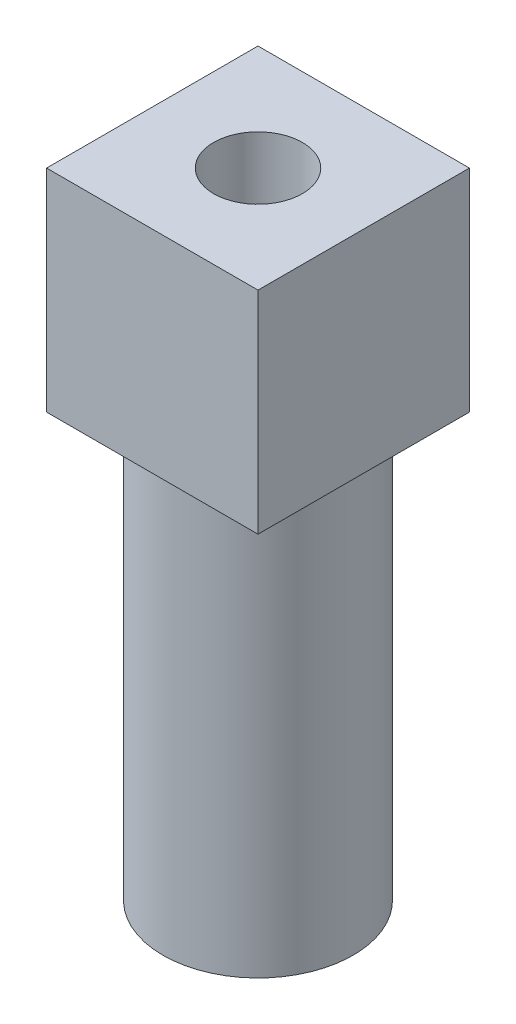
from build123d import *

# Parameters (mm, degrees)
SKIZZE1_W                       = 4.5
SKIZZE1_H                       = 20
SKIZZE5_W                       = 10
SKIZZE5_H                       = 10
AUFSATZ_LINEAR_AUSTRAGEN1_DEPTH = 10
M5_GEWINDEBOHRUNG2_D            = 4.2


with BuildPart() as part:
    # Skizze1 → Rotation1 (revolve)
    with BuildSketch(Plane.XY, mode=Mode.PRIVATE) as rotation1_sk:
        with Locations((2.25, 10)):
            Rectangle(SKIZZE1_W, SKIZZE1_H)
    revolve(rotation1_sk.sketch.rotate(Axis((0, -2.459302686, 0), (0, 1, 0)), 90), axis=Axis((0, -2.459302686, 0), (0, 1, 0)))

    # Skizze5 → Aufsatz-Linear austragen1 (add)
    with BuildSketch(Plane(origin=(0, 20, 0), x_dir=(1, 0, 0), z_dir=(0, 1, 0))):
        Rectangle(SKIZZE5_W, SKIZZE5_H)
    extrude(amount=AUFSATZ_LINEAR_AUSTRAGEN1_DEPTH)

    # M5 Gewindebohrung2 (through all)
    with Locations(Plane(origin=(0, 30, 0), x_dir=(1, 0, 0), z_dir=(0, 1, 0))):
        with Locations((0, 0)):
            Hole(M5_GEWINDEBOHRUNG2_D / 2)


solid = part.part
